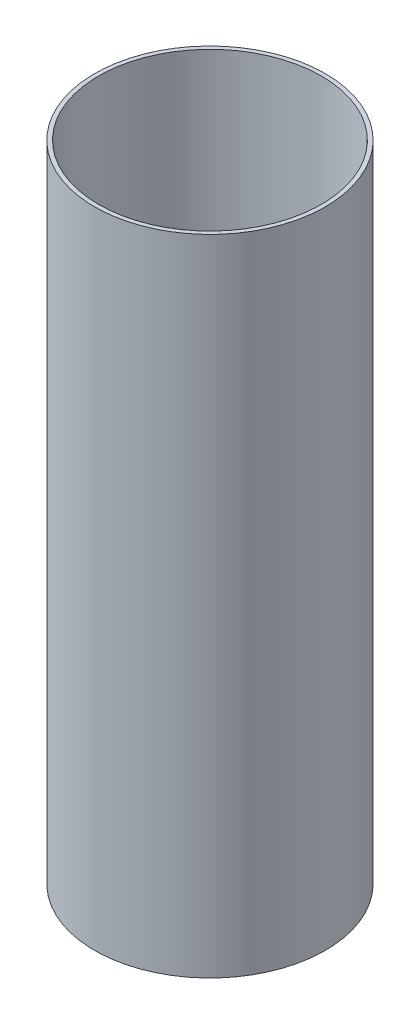
from build123d import *

# Parameters (mm, degrees)
SKETCH1_R           = 27.305
SKETCH1_R_2         = 26.35
BOSS_EXTRUDE1_DEPTH = 152.4


with BuildPart() as part:
    # Sketch1 → Boss-Extrude1 (new body)
    with BuildSketch(Plane(origin=(0, 0, 0), x_dir=(1, 0, 0), z_dir=(0, 1, 0))):
        with Locations(Location((0, 0, 0), (0, 0, 90))):
            Circle(SKETCH1_R)
        with Locations(Location((0, 0, 0), (0, 0, 90))):
            Circle(SKETCH1_R_2, mode=Mode.SUBTRACT)
    extrude(amount=BOSS_EXTRUDE1_DEPTH)


solid = part.part
